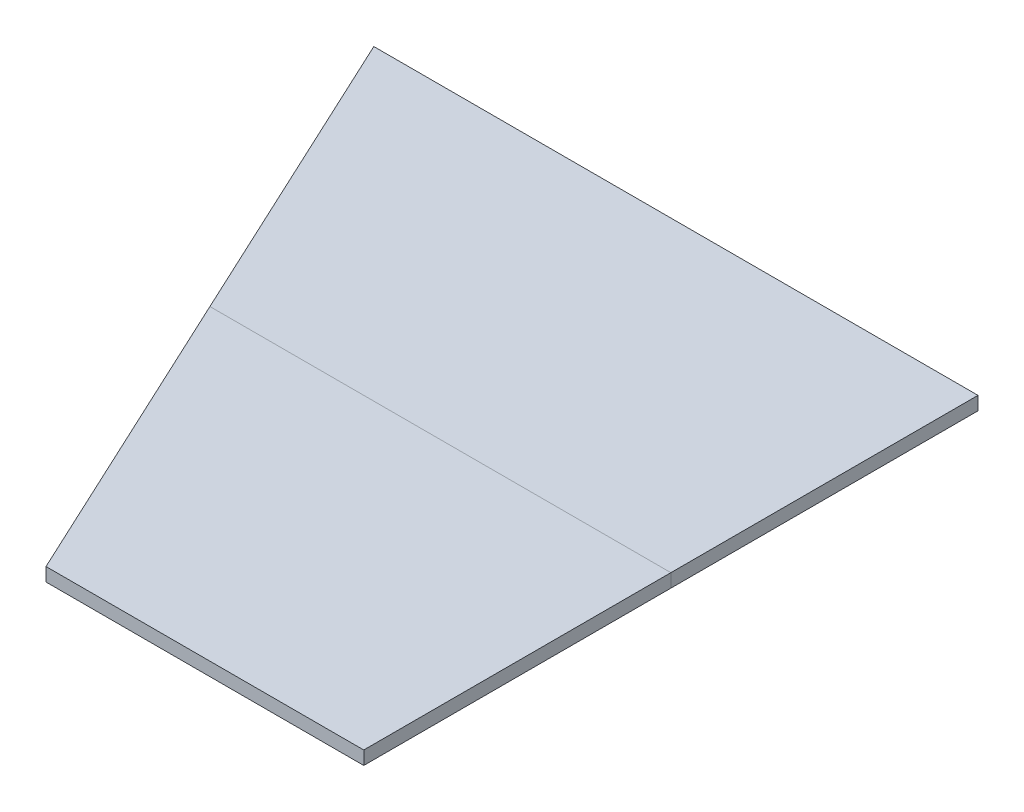
from build123d import *

# Parameters (mm, degrees)
BOSS_EXTRUDE1_DEPTH = 4


with BuildPart() as part:
    # Sketch1 → Boss-Extrude1 (new body)
    with BuildSketch(Plane(origin=(0, 0, 0), x_dir=(1, 0, 0), z_dir=(0, 1, 0))):
        Polygon((-90, 0), (90, 0), (90, -183), (-4.665698558, -183), align=None)
    extrude(amount=BOSS_EXTRUDE1_DEPTH)


with BuildPart() as body_2:
    # Split1: the piece on the far side of the plane
    add(part.part)
    split(bisect_by=Plane(origin=(0, 0, 91.5), x_dir=(-1, 0, 0), z_dir=(0, 0, -1)), keep=Keep.BOTTOM)


with BuildPart() as part_1:
    add(part.part)

    # Split1
    split(bisect_by=Plane(origin=(0, 0, 91.5), x_dir=(-1, 0, 0), z_dir=(0, 0, -1)), keep=Keep.TOP)


solid = Compound([body_2.part, part_1.part])
